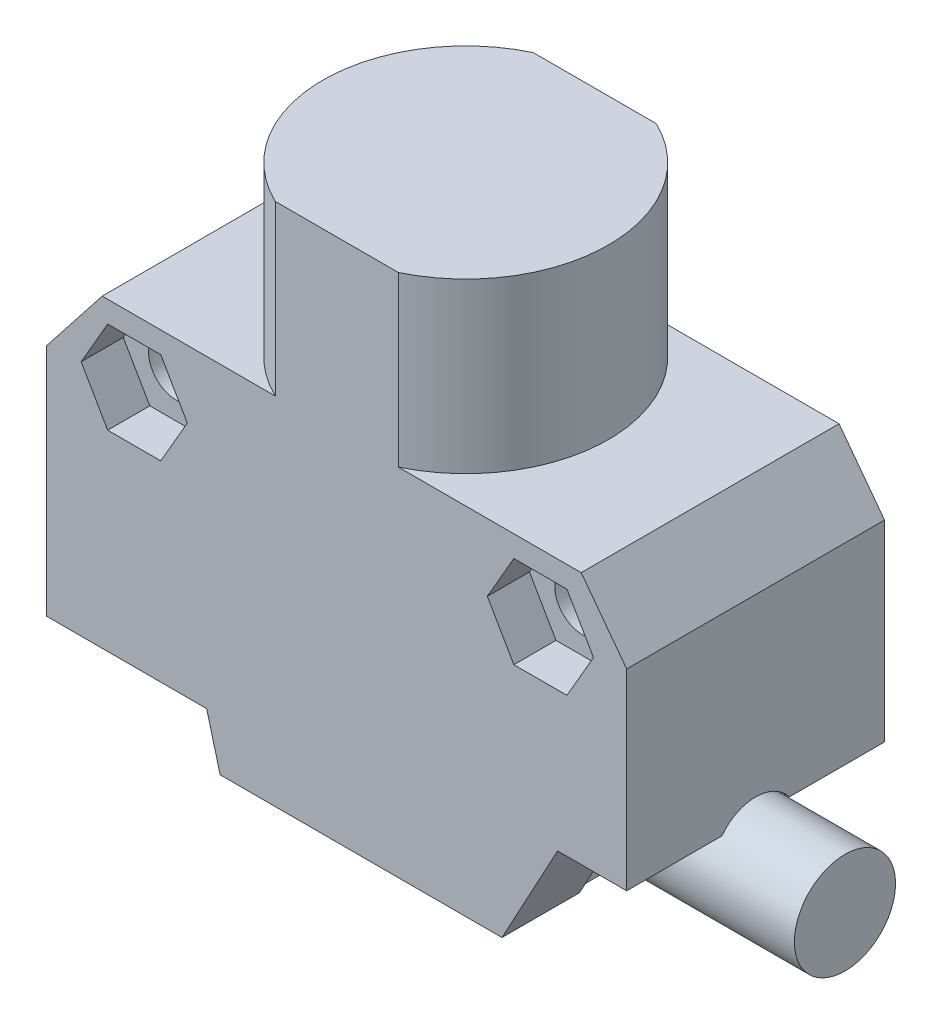
from build123d import *

# Parameters (mm, degrees)
SKETCH1_W                    = 34.42
SKETCH1_H                    = 15.3
BOSS_EXTRUDE1_DEPTH          = 21.1
CHAMFER1_SIZE                = 3.6
CHAMFER1_SIZE2               = 2.7
CHAMFER2_SIZE                = 4.2
CHAMFER2_SIZE2               = 3.3
CUT_EXTRUDE1_DEPTH           = 32.232740834
SKETCH3_R                    = 8.475
BOSS_EXTRUDE2_DEPTH          = 10
CUT_EXTRUDE2_REACH           = 30.517
F_0_15_0_15_DIAMETER_HOLE1_D = 3.3
F_0_15_0_15_DIAMETER_HOLE2_D = 3.3
CUT_EXTRUDE3_DEPTH           = 2.5
CUT_EXTRUDE4_START           = -15.3
CUT_EXTRUDE4_DEPTH           = 2.5
SKETCH10_W                   = 6.1
SKETCH10_H                   = 6.1
CUT_EXTRUDE5_DEPTH           = 7.7
CUT_EXTRUDE6_DEPTH           = 7.7
SKETCH12_R                   = 3
BOSS_EXTRUDE3_DEPTH          = 13


with BuildPart() as part:
    # Sketch1 → Boss-Extrude1 (new body)
    with BuildSketch(Plane(origin=(0, 0, 0), x_dir=(1, 0, 0), z_dir=(0, 1, 0))):
        Rectangle(SKETCH1_W, SKETCH1_H)
    extrude(amount=BOSS_EXTRUDE1_DEPTH)

    # Chamfer1
    chamfer1_edges = [part.edges().sort_by_distance(p)[0] for p in [
        (17.21, 21.1, 0),
    ]]
    chamfer1_side = [part.faces().sort_by_distance(p)[0] for p in [
        (17.21, 10.55, 0),
    ]]
    chamfer(chamfer1_edges, length=CHAMFER1_SIZE, length2=CHAMFER1_SIZE2, reference=chamfer1_side[0])

    # Chamfer2
    chamfer2_edges = [part.edges().sort_by_distance(p)[0] for p in [
        (-17.21, 21.1, 0),
    ]]
    chamfer2_side = [part.faces().sort_by_distance(p)[0] for p in [
        (-17.21, 10.55, 0),
    ]]
    chamfer(chamfer2_edges, length=CHAMFER2_SIZE, length2=CHAMFER2_SIZE2, reference=chamfer2_side[0])

    # Sketch2 → Cut-Extrude1 (cut, through all)
    with BuildSketch(Plane.XY.offset(7.65)):
        Polygon((-17.21, 3), (-7.71, 3), (-6.91, 0), (-17.21, 0), align=None)
        Polygon((17.21, 6.1), (13.11, 6.1), (9.81, 0), (17.21, 0), align=None)
    extrude(amount=-CUT_EXTRUDE1_DEPTH, mode=Mode.SUBTRACT)

    # Sketch3 → Boss-Extrude2 (add)
    with BuildSketch(Plane(origin=(0, 21.1, 0), x_dir=(1, 0, 0), z_dir=(0, 1, 0))):
        with Locations(Location((0.01, 0, 0), (0, 0, 64.509262206))):
            Circle(SKETCH3_R)
    extrude(amount=BOSS_EXTRUDE2_DEPTH)

    # Sketch4 → Cut-Extrude2 (cut, up to next)
    with BuildSketch(Plane.XZ.offset(-21.1), mode=Mode.PRIVATE) as cut_extrude2_sk1:
        with BuildLine():
            Line((-3.637344925, -7.65), (3.657344925, -7.65))
            ThreePointArc((3.657344925, -7.65), (0.01, -8.475), (-3.637344925, -7.65))
        make_face()
    cut_extrude2_tool1 = extrude(cut_extrude2_sk1.sketch, amount=-CUT_EXTRUDE2_REACH, mode=Mode.PRIVATE) & part.part
    # Sketch4 → Cut-Extrude2 (cut, up to next)
    with BuildSketch(Plane.XZ.offset(-21.1), mode=Mode.PRIVATE) as cut_extrude2_sk2:
        with BuildLine():
            Line((-3.637344925, 7.65), (3.657344925, 7.65))
            ThreePointArc((3.657344925, 7.65), (0.01, 8.475), (-3.637344925, 7.65))
        make_face()
    cut_extrude2_tool2 = extrude(cut_extrude2_sk2.sketch, amount=-CUT_EXTRUDE2_REACH, mode=Mode.PRIVATE) & part.part
    add(cut_extrude2_tool1.solids().sort_by_distance((0.01, 21.1, -7.981417))[0], mode=Mode.SUBTRACT)
    add(cut_extrude2_tool2.solids().sort_by_distance((0.01, 21.1, 7.981417))[0], mode=Mode.SUBTRACT)

    # Ø0.15 (0.15) Diameter Hole1 (through all)
    with Locations(Plane.XY.offset(7.65)):
        with Locations((-12.01, 17.1)):
            Hole(F_0_15_0_15_DIAMETER_HOLE1_D / 2)

    # Ø0.15 (0.15) Diameter Hole2 (through all)
    with Locations(Plane.XY.offset(7.65)):
        with Locations((12.09, 17.1)):
            Hole(F_0_15_0_15_DIAMETER_HOLE2_D / 2)

    # Sketch9 → Cut-Extrude3 (cut)
    with BuildSketch(Plane.XY.offset(7.65)):
        Polygon((8.94, 17.1), (10.515, 14.372019978), (13.665, 14.372019978), (15.24, 17.1), (13.665, 19.827980022), (10.515, 19.827980022), align=None)
        Polygon((-15.16, 17.1), (-13.585, 14.372019978), (-10.435, 14.372019978), (-8.86, 17.1), (-10.435, 19.827980022), (-13.585, 19.827980022), align=None)
    extrude(amount=-CUT_EXTRUDE3_DEPTH, mode=Mode.SUBTRACT)

    # Sketch9<2> → Cut-Extrude4 (cut)
    with BuildSketch(Plane.XY.offset(7.65).offset(CUT_EXTRUDE4_START)):
        Polygon((8.94, 17.1), (10.515, 14.372019978), (13.665, 14.372019978), (15.24, 17.1), (13.665, 19.827980022), (10.515, 19.827980022), align=None)
        Polygon((-15.16, 17.1), (-13.585, 14.372019978), (-10.435, 14.372019978), (-8.86, 17.1), (-10.435, 19.827980022), (-13.585, 19.827980022), align=None)
    extrude(amount=CUT_EXTRUDE4_DEPTH, mode=Mode.SUBTRACT)

    # Sketch10 → Cut-Extrude5 (cut)
    with BuildSketch(Plane(origin=(17.21, 0, 0), x_dir=(0, 0, -1), z_dir=(1, 0, 0))):
        with Locations((0, 3.05)):
            Rectangle(SKETCH10_W, SKETCH10_H)
    extrude(amount=-CUT_EXTRUDE5_DEPTH, mode=Mode.SUBTRACT)

    # Sketch11 → Cut-Extrude6 (cut)
    with BuildSketch(Plane(origin=(17.21, 0, 0), x_dir=(0, 0, -1), z_dir=(1, 0, 0))):
        with BuildLine():
            Line((2, 6.1), (-2, 6.1))
            ThreePointArc((-2, 6.1), (0, 7.1), (2, 6.1))
        make_face()
    extrude(amount=-CUT_EXTRUDE6_DEPTH, mode=Mode.SUBTRACT)

    # Sketch12 → Boss-Extrude3 (add)
    with BuildSketch(Plane(origin=(9.51, 0, 0), x_dir=(0, 0, -1), z_dir=(1, 0, 0))):
        with Locations(Location((0, 3.8, 0), (0, 0, 180))):
            Circle(SKETCH12_R)
    extrude(amount=BOSS_EXTRUDE3_DEPTH)


solid = part.part
